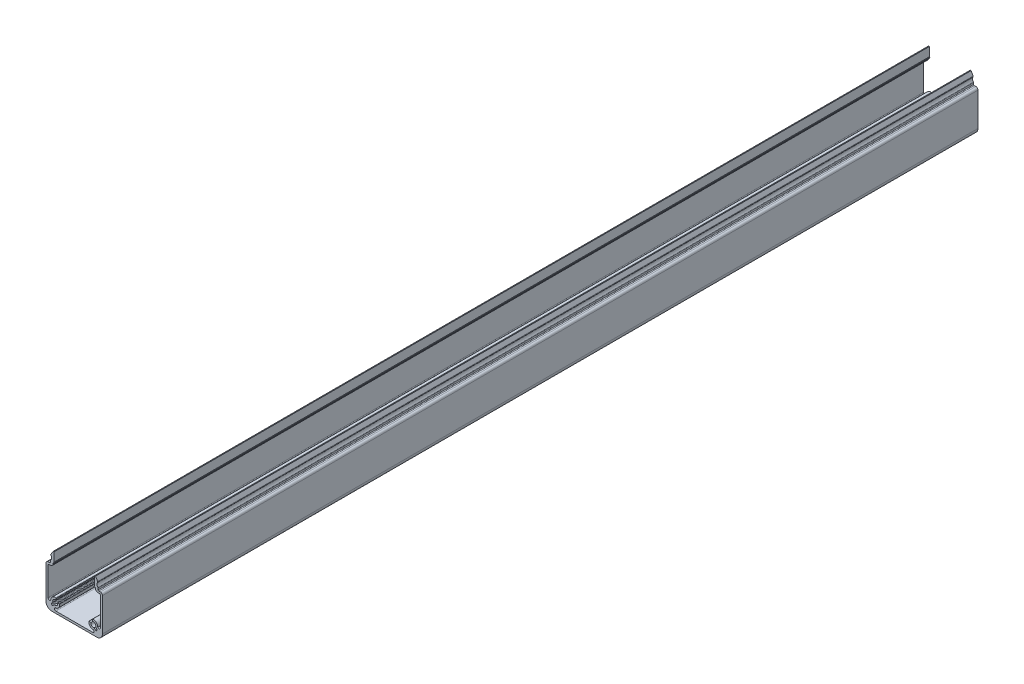
from build123d import *

# Parameters (mm, degrees)
BOSS_EXTRUDE1_DEPTH = 620


with BuildPart() as part:
    # Sketch1 → Boss-Extrude1 (new body)
    with BuildSketch(Plane.XY.offset(20)):
        with BuildLine():
            Line((4, 0), (36, 0))
            ThreePointArc((36, 0), (38.828427125, 1.171572875), (40, 4))
            Line((40, 4), (40, 27.499999994))
            ThreePointArc((40, 27.499999994), (39.56066017, 28.56066017), (38.499999994, 29))
            Line((38.499999994, 29), (37.408493132, 29))
            ThreePointArc((37.408493132, 29), (37.05493974, 29.14644661), (36.90849313, 29.500000002))
            Line((36.90849313, 29.500000002), (36.90849313, 30.572020267))
            ThreePointArc((36.90849313, 30.572020267), (36.86079319, 30.785150869), (36.726794508, 30.957616203))
            ThreePointArc((36.726794508, 30.957616203), (36.005111578, 32.357100716), (36.519951827, 33.845160752))
            ThreePointArc((36.519951827, 33.845160752), (36.647077826, 34.128030253), (36.582952488, 34.431450944))
            Line((36.582952488, 34.431450944), (35.099999998, 37.000000001))
            Line((35.099999998, 37.000000001), (34.500000002, 37.000000001))
            Line((34.500000002, 37.000000001), (34.500000002, 30.672689193))
            Line((34.500000002, 30.672689193), (34.158493132, 30.561067543))
            Line((34.158493132, 30.561067543), (34.158493132, 29.989862813))
            Line((34.158493132, 29.989862813), (34.908493132, 29.989862813))
            Line((34.908493132, 29.989862813), (34.908493132, 29.700000011))
            ThreePointArc((34.908493132, 29.700000011), (35.494279572, 28.285786443), (36.908493141, 27.700000003))
            Line((36.908493141, 27.700000003), (38.000000017, 27.700000003))
            ThreePointArc((38.000000017, 27.700000003), (38.353553409, 27.553553393), (38.500000019, 27.200000001))
            Line((38.500000019, 27.200000001), (38.500000019, 6.9547727))
            ThreePointArc((38.500000019, 6.9547727), (37.882683451, 6.030893167), (36.792893237, 6.247665919))
            Line((36.792893237, 6.247665919), (36.648161659, 6.392397496))
            ThreePointArc((36.648161659, 6.392397496), (35.587251229, 8.859212237), (33.009530056, 9.611581471))
            ThreePointArc((33.009530056, 9.611581471), (32.804700675, 9.478725012), (32.766463725, 9.237594653))
            Line((32.766463725, 9.237594653), (33.047066675, 8.190370192))
            ThreePointArc((33.047066675, 8.190370192), (34.786339421, 7.686520507), (35.148364083, 5.912296075))
            Line((35.148364083, 5.912296075), (36.146446608, 4.91421355))
            ThreePointArc((36.146446608, 4.91421355), (36.292893217, 4.560660161), (36.146446608, 4.207106773))
            Line((36.146446608, 4.207106773), (35.792893214, 3.853553379))
            ThreePointArc((35.792893214, 3.853553379), (35.439339826, 3.70710677), (35.085786437, 3.853553379))
            Line((35.085786437, 3.853553379), (34.087703906, 4.85163591))
            ThreePointArc((34.087703906, 4.85163591), (32.313479487, 5.213660585), (31.809629807, 6.952933321))
            Line((31.809629807, 6.952933321), (30.762405333, 7.233536272))
            ThreePointArc((30.762405333, 7.233536272), (30.521274984, 7.195299323), (30.38841853, 6.990469949))
            ThreePointArc((30.38841853, 6.990469949), (31.140787752, 4.412748784), (33.607602477, 3.351838341))
            Line((33.607602477, 3.351838341), (33.752334032, 3.207106785))
            ThreePointArc((33.752334032, 3.207106785), (33.969106782, 2.117316579), (33.045227255, 1.500000015))
            Line((33.045227255, 1.500000015), (6.954772716, 1.500000015))
            ThreePointArc((6.954772716, 1.500000015), (6.030893183, 2.117316583), (6.247665934, 3.207106797))
            Line((6.247665934, 3.207106797), (6.392397512, 3.351838375))
            ThreePointArc((6.392397512, 3.351838375), (8.859212224, 4.412748803), (9.611581449, 6.990469949))
            ThreePointArc((9.611581449, 6.990469949), (9.478724996, 7.195299323), (9.237594646, 7.233536272))
            Line((9.237594646, 7.233536272), (8.190370187, 6.952933328))
            ThreePointArc((8.190370187, 6.952933328), (7.686520502, 5.213660596), (5.912296085, 4.851635932))
            Line((5.912296085, 4.851635932), (4.914213553, 3.8535534))
            ThreePointArc((4.914213553, 3.8535534), (4.560660164, 3.707106791), (4.207106776, 3.8535534))
            Line((4.207106776, 3.8535534), (3.853553388, 4.207106787))
            ThreePointArc((3.853553388, 4.207106787), (3.70710678, 4.560660175), (3.853553388, 4.914213564))
            Line((3.853553388, 4.914213564), (4.85163592, 5.912296095))
            ThreePointArc((4.85163592, 5.912296095), (5.213660585, 7.686520517), (6.952933322, 8.190370198))
            Line((6.952933322, 8.190370198), (7.233536268, 9.237594644))
            ThreePointArc((7.233536268, 9.237594644), (7.195299318, 9.478725003), (6.990469936, 9.611581462))
            ThreePointArc((6.990469936, 9.611581462), (4.412748785, 8.859212233), (3.351838362, 6.392397513))
            Line((3.351838362, 6.392397513), (3.207106785, 6.247665935))
            ThreePointArc((3.207106785, 6.247665935), (2.11731657, 6.030893183), (1.500000002, 6.954772717))
            Line((1.500000002, 6.954772717), (1.500000002, 27.200000001))
            ThreePointArc((1.500000002, 27.200000001), (1.646446612, 27.553553393), (2.000000004, 27.700000003))
            Line((2.000000004, 27.700000003), (3.091506864, 27.700000003))
            ThreePointArc((3.091506864, 27.700000003), (4.505720432, 28.285786443), (5.091506872, 29.700000011))
            Line((5.091506872, 29.700000011), (5.091506872, 29.989862813))
            Line((5.091506872, 29.989862813), (5.841506868, 29.989862813))
            Line((5.841506868, 29.989862813), (5.841506868, 30.561067541))
            Line((5.841506868, 30.561067541), (5.499999998, 30.672689191))
            Line((5.499999998, 30.672689191), (5.499999998, 37.000000001))
            Line((5.499999998, 37.000000001), (4.899999998, 37.000000001))
            Line((4.899999998, 37.000000001), (3.417047508, 34.431450944))
            ThreePointArc((3.417047508, 34.431450944), (3.35292217, 34.128030253), (3.480048169, 33.845160751))
            ThreePointArc((3.480048169, 33.845160751), (3.99488842, 32.357100716), (3.273205491, 30.957616203))
            ThreePointArc((3.273205491, 30.957616203), (3.13920681, 30.785150869), (3.09150687, 30.572020267))
            Line((3.09150687, 30.572020267), (3.09150687, 29.500000002))
            ThreePointArc((3.09150687, 29.500000002), (2.94506026, 29.14644661), (2.591506868, 29))
            Line((2.591506868, 29), (1.500000006, 29))
            ThreePointArc((1.500000006, 29), (0.43933983, 28.56066017), (0, 27.499999994))
            Line((0, 27.499999994), (0, 4))
            ThreePointArc((0, 4), (1.171572875, 1.171572875), (4, 0))
        make_face()
    extrude(amount=-BOSS_EXTRUDE1_DEPTH)


solid = part.part
